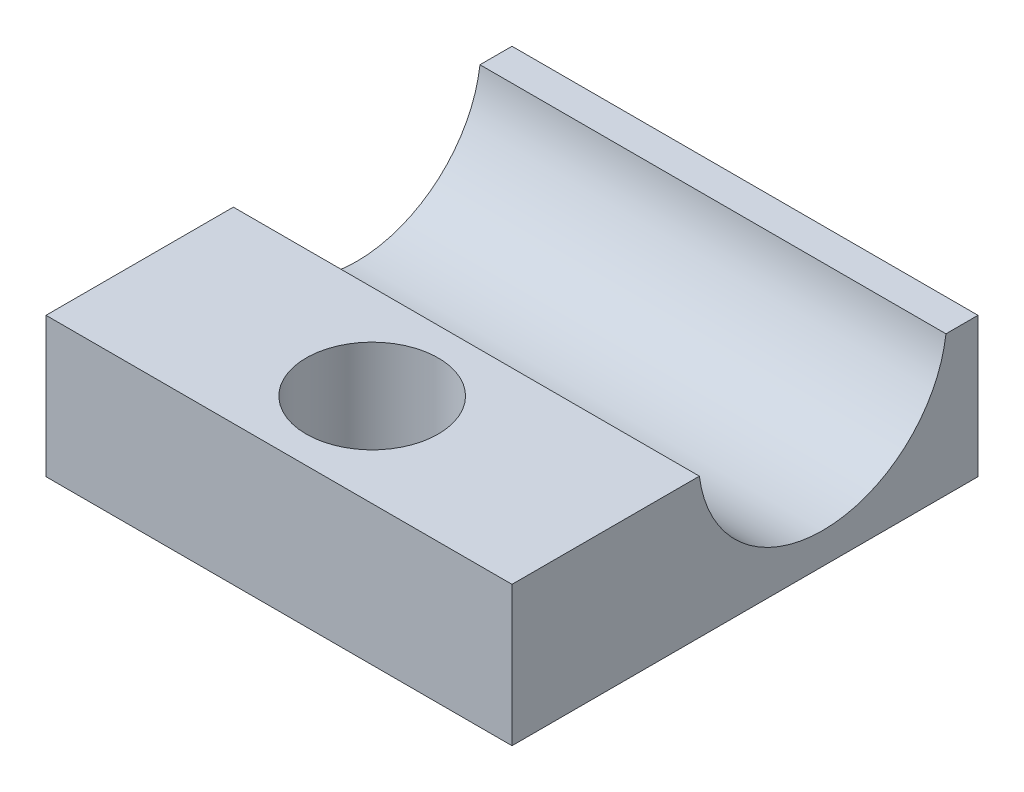
from build123d import *

# Parameters (mm, degrees)
SKETCH1_W           = 15
SKETCH1_H           = 15
SKETCH1_R           = 2.125
BOSS_EXTRUDE1_DEPTH = 4.5
CUT_EXTRUDE1_REACH  = 23.685
SKETCH2_R           = 4


with BuildPart() as part:
    # Sketch1 → Boss-Extrude1 (new body)
    with BuildSketch(Plane(origin=(0, 0, 0), x_dir=(1, 0, 0), z_dir=(0, 1, 0))):
        with Locations((-7.5, 7.5)):
            Rectangle(SKETCH1_W, SKETCH1_H)
        with Locations(Location((-7.5, 3, 0), (0, 0, 270))):
            Circle(SKETCH1_R, mode=Mode.SUBTRACT)
    extrude(amount=BOSS_EXTRUDE1_DEPTH)

    # Sketch2 → Cut-Extrude1 (cut, up to next)
    with BuildSketch(Plane(origin=(0, 0, 0), x_dir=(0, 0, -1), z_dir=(1, 0, 0)), mode=Mode.PRIVATE) as cut_extrude1_sk1:
        with Locations((10, 5)):
            Circle(SKETCH2_R)
    cut_extrude1_tool1 = extrude(cut_extrude1_sk1.sketch, amount=-CUT_EXTRUDE1_REACH, mode=Mode.PRIVATE) & part.part
    add(cut_extrude1_tool1.solids().sort_by_distance((0, 5, -10))[0], mode=Mode.SUBTRACT)


solid = part.part
